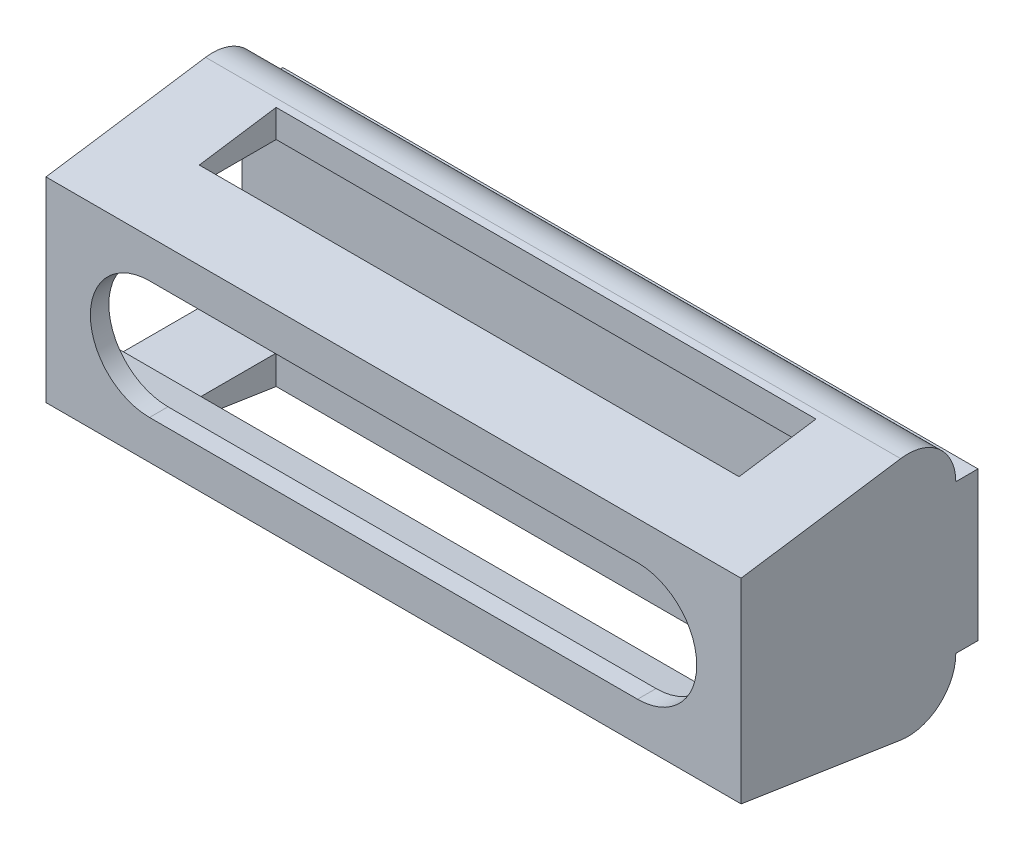
from build123d import *

# Parameters (mm, degrees)
BOSS_EXTRUDE4_DEPTH      = 47
BOSS_EXTRUDE4_DEPTH_BACK = 47
CUT_EXTRUDE1_DEPTH       = 46
CUT_EXTRUDE1_DEPTH_BACK  = 57.471725617
CUT_EXTRUDE2_DEPTH       = 58.688817922
CUT_EXTRUDE2_DEPTH_BACK  = 2.5
CUT_EXTRUDE3_DEPTH       = 57.471725617
CUT_EXTRUDE3_DEPTH_BACK  = 57.471725617
SKETCH22_W               = 73
SKETCH22_H               = 10.4
CUT_EXTRUDE6_DEPTH       = 93
BOSS_EXTRUDE5_START      = -47
SKETCH27_W               = 3
SKETCH27_H               = 20.116454501
BOSS_EXTRUDE5_DEPTH      = 94
SKETCH28_R               = 2
CUT_EXTRUDE7_DEPTH       = 4


with BuildPart() as part:
    # Sketch20 → Boss-Extrude4 (new, two sides: drawn at the far end of the back side and taken through both)
    with BuildSketch(Plane(origin=(0, 0, 0), x_dir=(0, 0, -1), z_dir=(1, 0, 0)).offset(-BOSS_EXTRUDE4_DEPTH_BACK)):
        with BuildLine():
            Line((-26.538783814, 13.222085074), (-26.538783814, -13.211554854))
            Line((-26.538783814, -13.211554854), (-4.989273697, -16.529961404))
            ThreePointArc((-4.989273697, -16.529961404), (0.232004311, -15.039256896), (2.5, -10.105684203))
            Line((2.5, -10.105684203), (2.5, 10.010770298))
            ThreePointArc((2.5, 10.010770298), (0.243783068, 14.93421475), (-4.958555469, 16.439702667))
            Line((-4.958555469, 16.439702667), (-26.538783814, 13.222085074))
        make_face()
    extrude(amount=BOSS_EXTRUDE4_DEPTH + BOSS_EXTRUDE4_DEPTH_BACK)

    # Sketch19 → Cut-Extrude1 (cut, two sides: drawn at the far end of the back side and taken through both)
    with BuildSketch(Plane(origin=(0, 0, 0), x_dir=(0, 0, -1), z_dir=(1, 0, 0)).offset(-CUT_EXTRUDE1_DEPTH_BACK)):
        with BuildLine():
            Line((-24.038783814, 9.55061834), (-4.588783814, 12.45061834))
            ThreePointArc((-4.588783814, 12.45061834), (-1.422994415, 11.554530734), (0, 8.58800374))
            Line((0, 8.58800374), (0, -8.58800374))
            ThreePointArc((0, -8.58800374), (-1.395689655, -11.624048474), (-4.608783814, -12.541405094))
            Line((-4.608783814, -12.541405094), (-24.038783814, -9.54938166))
            Line((-24.038783814, -9.54938166), (-24.038783814, 9.55061834))
        make_face()
    extrude(amount=CUT_EXTRUDE1_DEPTH + CUT_EXTRUDE1_DEPTH_BACK, mode=Mode.SUBTRACT)

    # Sketch21 → Cut-Extrude2 (cut, two sides: drawn at the far end of the back side and taken through both)
    with BuildSketch(Plane.XY.offset(26.538783814).offset(-CUT_EXTRUDE2_DEPTH_BACK)):
        with BuildLine():
            Line((-32.999961179, 8.05061834), (33.000038821, 8.05061834))
            ThreePointArc((33.000038821, 8.05061834), (41.000038821, 0.05061834), (33.000038821, -7.94938166))
            Line((33.000038821, -7.94938166), (-32.999961179, -7.94938166))
            ThreePointArc((-32.999961179, -7.94938166), (-40.999961179, 0.05061834), (-32.999961179, 8.05061834))
        make_face()
    extrude(amount=CUT_EXTRUDE2_DEPTH + CUT_EXTRUDE2_DEPTH_BACK, mode=Mode.SUBTRACT)

    # Sketch22 → Cut-Extrude3 (cut, two sides: drawn at the far end of the back side and taken through both)
    with BuildSketch(Plane(origin=(0, 0, 0), x_dir=(1, 0, 0), z_dir=(0, 1, 0)).offset(-CUT_EXTRUDE3_DEPTH_BACK)):
        with Locations((0, -11.108783814)):
            Rectangle(SKETCH22_W, SKETCH22_H)
    extrude(amount=CUT_EXTRUDE3_DEPTH + CUT_EXTRUDE3_DEPTH_BACK, mode=Mode.SUBTRACT)

    # Sketch26 → Cut-Extrude6 (cut)
    with BuildSketch(Plane.ZY.offset(-46)):
        Polygon((18.098783814, -10.464081567), (18.098783814, -12.474081567), (3.628783814, -12.474081567), (3.66965086, 12.536273867), (18.098783814, 12.536273867), (18.098783814, 10.436273867), align=None)
    extrude(amount=CUT_EXTRUDE6_DEPTH, mode=Mode.SUBTRACT)

    # Sketch27 → Boss-Extrude5 (add)
    with BuildSketch(Plane(origin=(0, 0, 0), x_dir=(0, 0, -1), z_dir=(1, 0, 0)).offset(BOSS_EXTRUDE5_START)):
        with Locations((4, -0.047456953)):
            Rectangle(SKETCH27_W, SKETCH27_H)
    extrude(amount=BOSS_EXTRUDE5_DEPTH)

    # Sketch28 → Cut-Extrude7 (cut)
    with BuildSketch(Plane(origin=(0, 0, -5.5), x_dir=(-1, 0, 0), z_dir=(0, 0, -1))):
        with Locations(Location((-24, 0, 0), (0, 0, 90))):
            Circle(SKETCH28_R)
        with Locations(Location((24, 0, 0), (0, 0, 90))):
            Circle(SKETCH28_R)
    extrude(amount=-CUT_EXTRUDE7_DEPTH, mode=Mode.SUBTRACT)


solid = part.part
